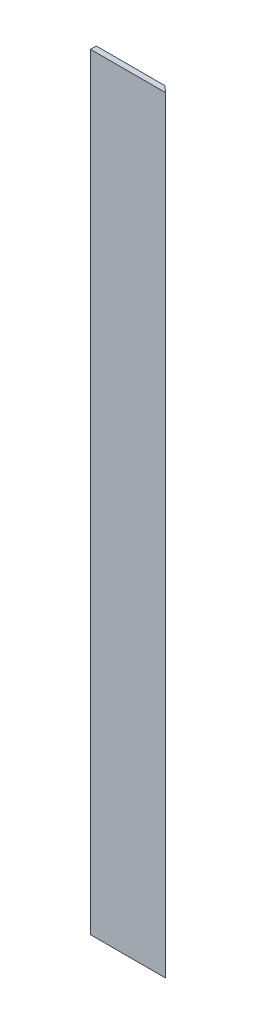
from build123d import *

# Parameters (mm, degrees)
EXTRUDE_1_DEPTH = 533


with BuildPart() as part:
    # Эскиз1 → Вытянуть1 (new body)
    with BuildSketch(Plane(origin=(0, 0, 0), x_dir=(1, 0, 0), z_dir=(0, 1, 0))):
        Polygon((0, -1), (47.762045872, -1), (52.102895451, -5), (0, -5), align=None)
    extrude(amount=EXTRUDE_1_DEPTH)


solid = part.part
